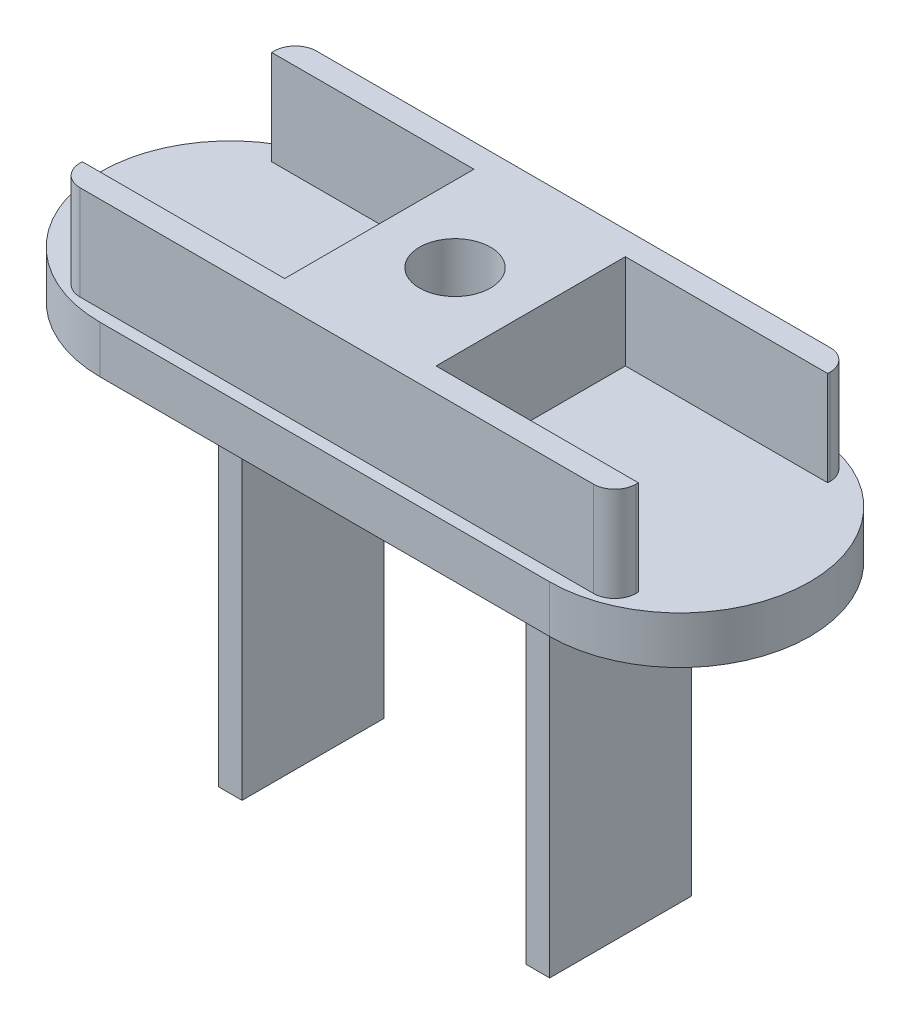
from build123d import *

# Parameters (mm, degrees)
SALIENTE_EXTRUIR1_DEPTH = 2
SALIENTE_EXTRUIR2_DEPTH = 4
CORTAR_EXTRUIR1_REACH   = 19.066
CROQUIS3_R              = 1.5
CROQUIS4_W              = 1
CROQUIS4_H              = 6
SALIENTE_EXTRUIR3_DEPTH = 15


with BuildPart() as part:
    # Croquis1 → Saliente-Extruir1 (new body)
    with BuildSketch(Plane(origin=(0, 0, 0), x_dir=(1, 0, 0), z_dir=(0, 1, 0))):
        with BuildLine():
            Line((-9.5, 5.5), (9.5, 5.5))
            ThreePointArc((9.5, 5.5), (15, 0), (9.5, -5.5))
            Line((9.5, -5.5), (-9.5, -5.5))
            ThreePointArc((-9.5, -5.5), (-15, 0), (-9.5, 5.5))
        make_face()
    extrude(amount=SALIENTE_EXTRUIR1_DEPTH)

    # Croquis2 → Saliente-Extruir2 (add)
    with BuildSketch(Plane(origin=(0, 2, 0), x_dir=(1, 0, 0), z_dir=(0, 1, 0))):
        with BuildLine():
            Line((-3.2, 4), (-3.2, -4))
            Line((-3.2, -4), (-11.75, -4))
            Line((-11.75, -4), (-11.75, -4.1))
            ThreePointArc((-11.75, -4.1), (-11.486396103, -4.736396103), (-10.85, -5))
            Line((-10.85, -5), (10.85, -5))
            ThreePointArc((10.85, -5), (11.486396103, -4.736396103), (11.75, -4.1))
            Line((11.75, -4.1), (11.75, -4))
            Line((11.75, -4), (3.2, -4))
            Line((3.2, -4), (3.2, 4))
            Line((3.2, 4), (11.75, 4))
            Line((11.75, 4), (11.75, 4.1))
            ThreePointArc((11.75, 4.1), (11.486396103, 4.736396103), (10.85, 5))
            Line((10.85, 5), (-10.85, 5))
            ThreePointArc((-10.85, 5), (-11.486396103, 4.736396103), (-11.75, 4.1))
            Line((-11.75, 4.1), (-11.75, 4))
            Line((-11.75, 4), (-3.2, 4))
        make_face()
    extrude(amount=SALIENTE_EXTRUIR2_DEPTH)

    # Croquis3 → Cortar-Extruir1 (cut, up to next)
    with BuildSketch(Plane(origin=(0, 6, 0), x_dir=(1, 0, 0), z_dir=(0, 1, 0)), mode=Mode.PRIVATE) as cortar_extruir1_sk1:
        with Locations(Location((0, 0, 0), (0, 0, 270))):
            Circle(CROQUIS3_R)
    cortar_extruir1_tool1 = extrude(cortar_extruir1_sk1.sketch, amount=-CORTAR_EXTRUIR1_REACH, mode=Mode.PRIVATE) & part.part
    add(cortar_extruir1_tool1.solids().sort_by_distance((0, 6, 0))[0], mode=Mode.SUBTRACT)

    # Croquis4 → Saliente-Extruir3 (add)
    with BuildSketch(Plane.XZ):
        with Locations((-6.5, 0)):
            Rectangle(CROQUIS4_W, CROQUIS4_H)
        with Locations((6.5, 0)):
            Rectangle(CROQUIS4_W, CROQUIS4_H)
    extrude(amount=SALIENTE_EXTRUIR3_DEPTH)


solid = part.part
